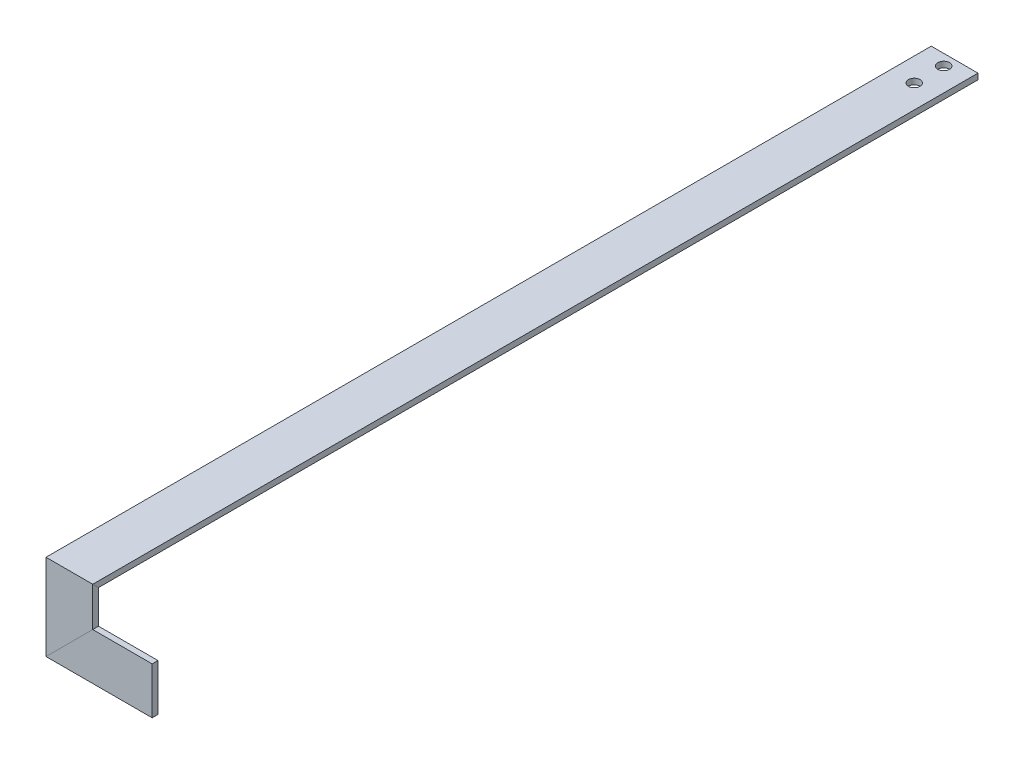
from build123d import *

# Parameters (mm, degrees)
CROQUIS1_W            = 50.8
CROQUIS1_H            = 6.31
CROQUIS2_R            = 6.35
CORTAR_EXTRUIR1_DEPTH = 6.31


with BuildPart() as part:
    # Barrer1: sweep along a curve in space
    with BuildLine() as barrer1_path:
        Line((0, 0, 0), (0, 0, 958.84))
        Line((0, 0, 958.84), (0, -64.9, 958.84))
        Line((0, -64.9, 958.84), (90, -64.9, 958.84))
    # Croquis1 → Barrer1 (sweep)
    with BuildSketch(Plane.XY):
        Rectangle(CROQUIS1_W, CROQUIS1_H)
    sweep(path=barrer1_path.line, transition=Transition.RIGHT)

    # Croquis2 → Cortar-Extruir1 (cut)
    with BuildSketch(Plane(origin=(0, 3.155, 0), x_dir=(1, 0, 0), z_dir=(0, 1, 0))):
        with Locations(Location((0, -43.892204666, 0), (0, 0, 270))):
            Circle(CROQUIS2_R)
        with Locations(Location((0, -11.892204666, 0), (0, 0, 270))):
            Circle(CROQUIS2_R)
    extrude(amount=-CORTAR_EXTRUIR1_DEPTH, mode=Mode.SUBTRACT)


solid = part.part
